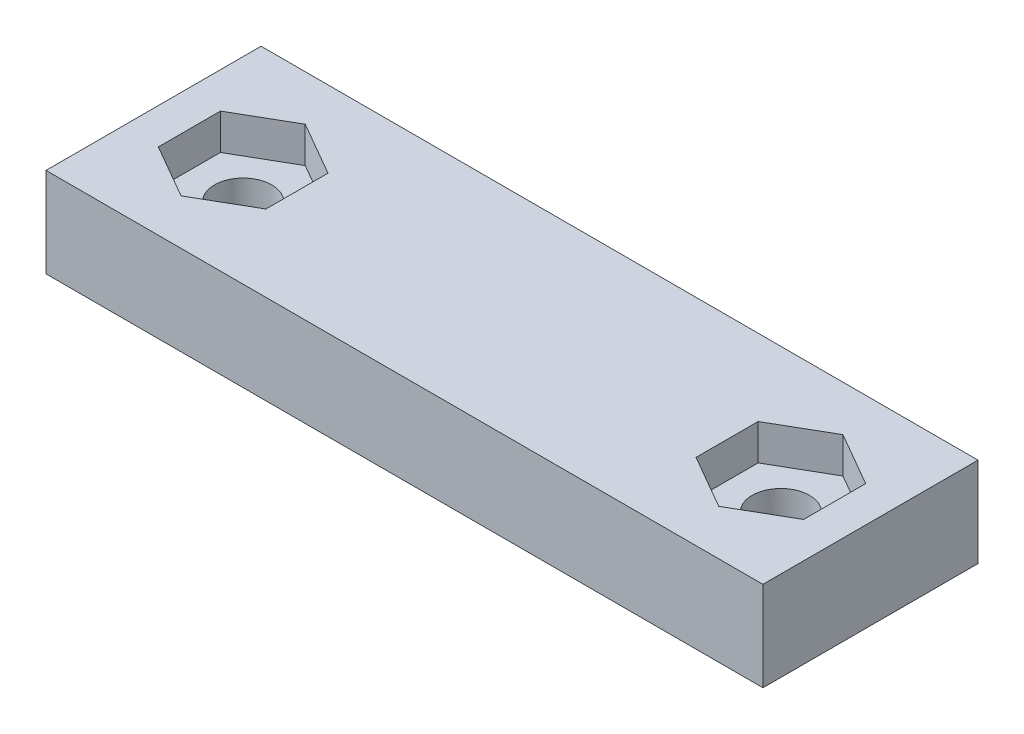
from build123d import *

# Parameters (mm, degrees)
SKETCH1_W           = 40
SKETCH1_H           = 12
BOSS_EXTRUDE1_DEPTH = 5
SKETCH2_R           = 1.6
CUT_EXTRUDE2_DEPTH  = 22.470910554
TEETH_DEPTH         = 5
TEETH_DEPTH_BACK    = 5
TEETH_START         = -20
SKETCH3_W           = 1
SKETCH3_H           = 1
CUT_EXTRUDE4_DEPTH  = 2


with BuildPart() as part:
    # Sketch1 → Boss-Extrude1 (new body)
    with BuildSketch(Plane(origin=(0, 0, 0), x_dir=(1, 0, 0), z_dir=(0, 1, 0))):
        Rectangle(SKETCH1_W, SKETCH1_H)
    extrude(amount=BOSS_EXTRUDE1_DEPTH)

    # Sketch2 → Cut-Extrude2 (cut, through all)
    with BuildSketch(Plane(origin=(0, 5, 0), x_dir=(1, 0, 0), z_dir=(0, 1, 0))):
        with Locations(Location((15, 0, 0), (0, 0, 270))):
            Circle(SKETCH2_R)
        with Locations(Location((-15, 0, 0), (0, 0, 90))):
            Circle(SKETCH2_R)
    extrude(amount=-CUT_EXTRUDE2_DEPTH, mode=Mode.SUBTRACT)

    # Sketch3 → Teeth (cut, two sides: drawn at the far end of the back side and taken through both)
    with BuildSketch(Plane.ZY.offset(20).offset(TEETH_START - TEETH_DEPTH_BACK)):
        with Locations((-4.75, 0.5)):
            Rectangle(SKETCH3_W, SKETCH3_H)
        with Locations((-2.75, 0.5)):
            Rectangle(SKETCH3_W, SKETCH3_H)
        with Locations((-0.75, 0.5)):
            Rectangle(SKETCH3_W, SKETCH3_H)
        with Locations((1.25, 0.5)):
            Rectangle(SKETCH3_W, SKETCH3_H)
        with Locations((3.25, 0.5)):
            Rectangle(SKETCH3_W, SKETCH3_H)
        with Locations((5.25, 0.5)):
            Rectangle(SKETCH3_W, SKETCH3_H)
        with Locations((7.25, 0.5)):
            Rectangle(SKETCH3_W, SKETCH3_H)
        with Locations((9.25, 0.5)):
            Rectangle(SKETCH3_W, SKETCH3_H)
    extrude(amount=TEETH_DEPTH + TEETH_DEPTH_BACK, mode=Mode.SUBTRACT)

    # Sketch4 → Cut-Extrude4 (cut)
    with BuildSketch(Plane(origin=(0, 5, 0), x_dir=(1, 0, 0), z_dir=(0, 1, 0))):
        Polygon((-15, 3.464101615), (-18, 1.732050808), (-18, -1.732050808), (-15, -3.464101615), (-12, -1.732050808), (-12, 1.732050808), align=None)
        Polygon((12, 1.732050808), (15, 3.464101615), (18, 1.732050808), (18, -1.732050808), (15, -3.464101615), (12, -1.732050808), align=None)
    extrude(amount=-CUT_EXTRUDE4_DEPTH, mode=Mode.SUBTRACT)


solid = part.part
